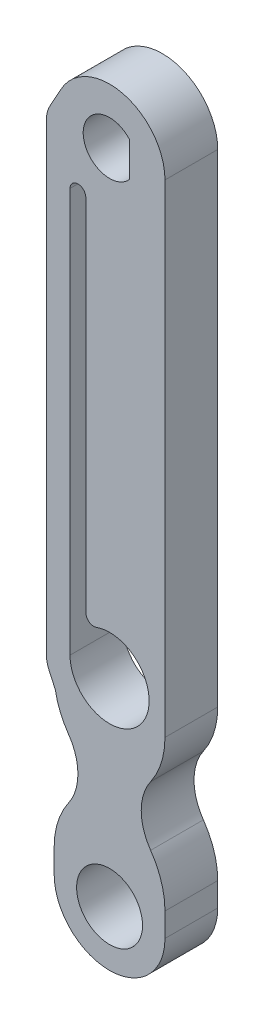
from build123d import *

# Parameters (mm, degrees)
SKETCH_1_R      = 2.5
EXTRUDE_1_DEPTH = 4


with BuildPart() as part:
    # 草图1 → 凸台-拉伸1 (new body)
    with BuildSketch(Plane.XY):
        with BuildLine():
            Line((-3.705318961, 51.777526587), (-4.499753228, 50.342391759))
            ThreePointArc((-4.499753228, 50.342391759), (-4.72372629, 49.780297575), (-4.8, 49.180050853))
            Line((-4.8, 49.180050853), (-4.8, 14.202498322))
            ThreePointArc((-4.8, 14.202498322), (-4.74482021, 13.6908166), (-4.581818179, 13.20266362))
            Line((-4.581818179, 13.20266362), (-4.112355754, 12.178212626))
            ThreePointArc((-4.112355754, 12.178212626), (-3.746152658, 10.910853721), (-3.111838791, 9.754156171))
            ThreePointArc((-3.111838791, 9.754156171), (-2.4, 7.5), (-3.111838791, 5.245843829))
            ThreePointArc((-3.111838791, 5.245843829), (-3.921495991, 3.606788208), (-4.2, 1.8))
            Line((-4.2, 1.8), (-4.2, 0))
            ThreePointArc((-4.2, 0), (0, -4.2), (4.2, 0))
            Line((4.2, 0), (4.2, 1.8))
            ThreePointArc((4.2, 1.8), (3.921495991, 3.606788208), (3.111838791, 5.245843829))
            ThreePointArc((3.111838791, 5.245843829), (2.4, 7.5), (3.111838791, 9.754156171))
            ThreePointArc((3.111838791, 9.754156171), (3.921495991, 11.393211792), (4.2, 13.2))
            Line((4.2, 13.2), (4.2, 49.8))
            ThreePointArc((4.2, 49.8), (1.019230191, 53.874453315), (-3.705318961, 51.777526587))
        make_face()
        Circle(SKETCH_1_R, mode=Mode.SUBTRACT)
        with BuildLine():
            Line((-3, 45.643078062), (-3, 15))
            ThreePointArc((-3, 15), (2.449489743, 13.267949192), (-1, 17.828427125))
            ThreePointArc((-1, 17.828427125), (-1.546410162, 17.904214601), (-1.8, 18.39411255))
            Line((-1.8, 18.39411255), (-1.8, 45.643078062))
            ThreePointArc((-1.8, 45.643078062), (-2.4, 46.243078062), (-3, 45.643078062))
        make_face(mode=Mode.SUBTRACT)
        with BuildLine():
            Line((1.5, 48.477124344), (1.5, 51.122875656))
            ThreePointArc((1.5, 51.122875656), (-2, 49.8), (1.5, 48.477124344))
        make_face(mode=Mode.SUBTRACT)
    extrude(amount=EXTRUDE_1_DEPTH)


solid = part.part
